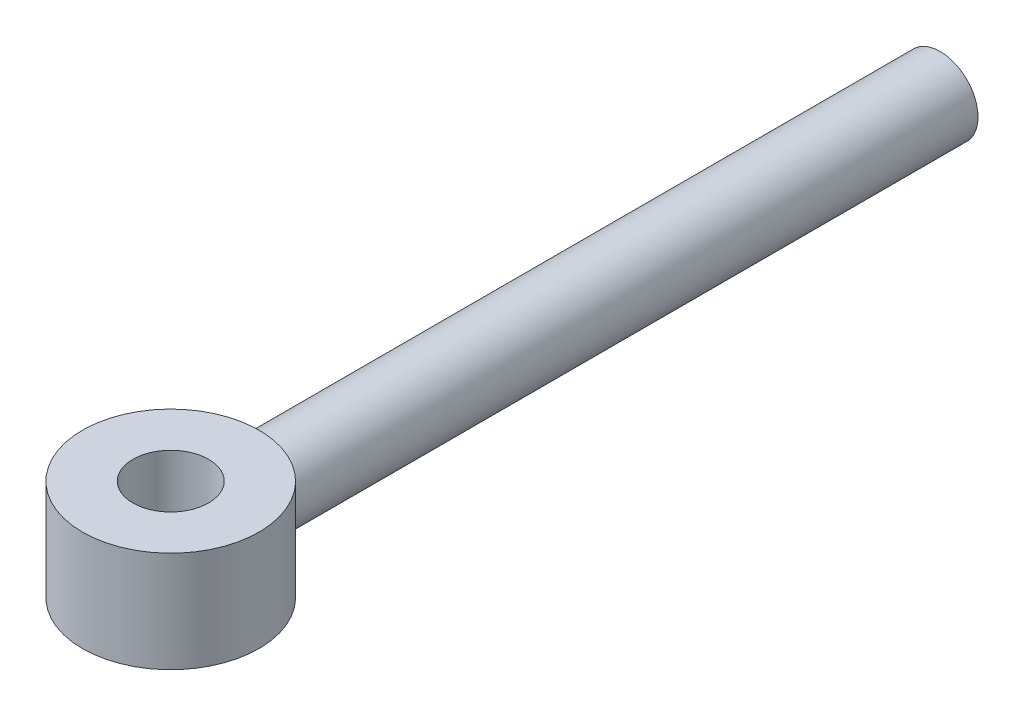
from build123d import *

# Parameters (mm, degrees)
SKETCH_1_R           = 3
EXTRUDE_1_DEPTH      = 55
EXTRUDE_2_DEPTH      = 4
EXTRUDE_2_DEPTH_BACK = 4
SKETCH_3_R           = 7
SKETCH_4_R           = 3
CUT_EXTRUDE_1_DEPTH  = 69.825867351


with BuildPart() as part:
    # Эскиз1 → Бобышка-Вытянуть1 (new body)
    with BuildSketch(Plane.XY):
        Circle(SKETCH_1_R)
    extrude(amount=EXTRUDE_1_DEPTH)

    # Эскиз3 → Бобышка-Вытянуть2 (add, two sides: drawn at the far end of the back side and taken through both)
    with BuildSketch(Plane(origin=(0, 0, 0), x_dir=(1, 0, 0), z_dir=(0, 1, 0)).offset(-EXTRUDE_2_DEPTH_BACK)):
        with Locations((0, -61)):
            Circle(SKETCH_3_R)
    extrude(amount=EXTRUDE_2_DEPTH + EXTRUDE_2_DEPTH_BACK)

    # Эскиз4 → Вырез-Вытянуть1 (cut, through all)
    with BuildSketch(Plane(origin=(0, 4, 0), x_dir=(1, 0, 0), z_dir=(0, 1, 0))):
        with Locations((0, -61)):
            Circle(SKETCH_4_R)
    extrude(amount=-CUT_EXTRUDE_1_DEPTH, mode=Mode.SUBTRACT)


solid = part.part
